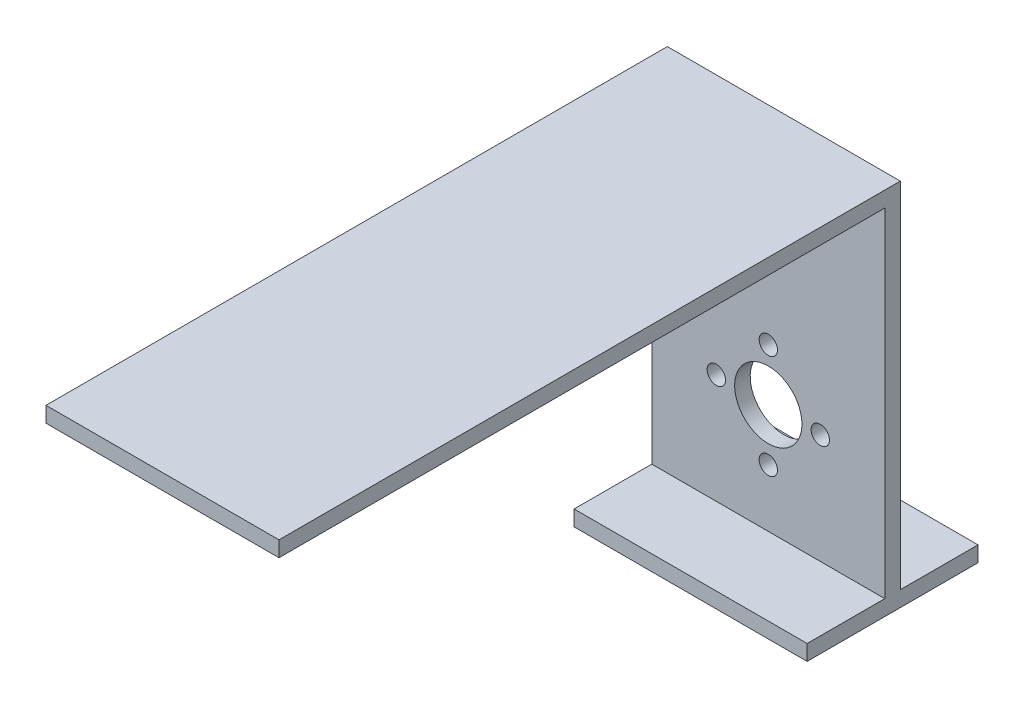
from build123d import *

# Parameters (mm, degrees)
BOSS_EXTRUDE1_DEPTH = 38.1
CUT_EXTRUDE2_REACH  = 122.881
SKETCH2_R           = 1.5
SKETCH2_R_2         = 5.5


with BuildPart() as part:
    # Sketch1 → Boss-Extrude1 (new body)
    with BuildSketch(Plane(origin=(0, 0, 0), x_dir=(0, 0, -1), z_dir=(1, 0, 0))):
        Polygon((-99.06, 57.86), (-99.06, 55.32), (0, 55.32), (0, 0), (-12.7, 0), (-12.7, -2.54), (15.24, -2.54), (15.24, 0), (2.54, 0), (2.54, 57.86), align=None)
    extrude(amount=BOSS_EXTRUDE1_DEPTH)

    # Sketch2 → Cut-Extrude2 (cut, up to next)
    with BuildSketch(Plane.XY, mode=Mode.PRIVATE) as cut_extrude2_sk1:
        with Locations((19.05, 26.42)):
            Circle(SKETCH2_R)
    cut_extrude2_tool1 = extrude(cut_extrude2_sk1.sketch, amount=-CUT_EXTRUDE2_REACH, mode=Mode.PRIVATE) & part.part
    # Sketch2 → Cut-Extrude2 (cut, up to next)
    with BuildSketch(Plane.XY, mode=Mode.PRIVATE) as cut_extrude2_sk2:
        with Locations((19.05, 9.42)):
            Circle(SKETCH2_R)
    cut_extrude2_tool2 = extrude(cut_extrude2_sk2.sketch, amount=-CUT_EXTRUDE2_REACH, mode=Mode.PRIVATE) & part.part
    # Sketch2 → Cut-Extrude2 (cut, up to next)
    with BuildSketch(Plane.XY, mode=Mode.PRIVATE) as cut_extrude2_sk3:
        with Locations((27.55, 17.92)):
            Circle(SKETCH2_R)
    cut_extrude2_tool3 = extrude(cut_extrude2_sk3.sketch, amount=-CUT_EXTRUDE2_REACH, mode=Mode.PRIVATE) & part.part
    # Sketch2 → Cut-Extrude2 (cut, up to next)
    with BuildSketch(Plane.XY, mode=Mode.PRIVATE) as cut_extrude2_sk4:
        with Locations((10.55, 17.92)):
            Circle(SKETCH2_R)
    cut_extrude2_tool4 = extrude(cut_extrude2_sk4.sketch, amount=-CUT_EXTRUDE2_REACH, mode=Mode.PRIVATE) & part.part
    # Sketch2 → Cut-Extrude2 (cut, up to next)
    with BuildSketch(Plane.XY, mode=Mode.PRIVATE) as cut_extrude2_sk5:
        with Locations((19.05, 17.92)):
            Circle(SKETCH2_R_2)
    cut_extrude2_tool5 = extrude(cut_extrude2_sk5.sketch, amount=-CUT_EXTRUDE2_REACH, mode=Mode.PRIVATE) & part.part
    add(cut_extrude2_tool1.solids().sort_by_distance((19.05, 26.42, 0))[0], mode=Mode.SUBTRACT)
    add(cut_extrude2_tool2.solids().sort_by_distance((19.05, 9.42, 0))[0], mode=Mode.SUBTRACT)
    add(cut_extrude2_tool3.solids().sort_by_distance((27.55, 17.92, 0))[0], mode=Mode.SUBTRACT)
    add(cut_extrude2_tool4.solids().sort_by_distance((10.55, 17.92, 0))[0], mode=Mode.SUBTRACT)
    add(cut_extrude2_tool5.solids().sort_by_distance((19.05, 17.92, 0))[0], mode=Mode.SUBTRACT)


solid = part.part
